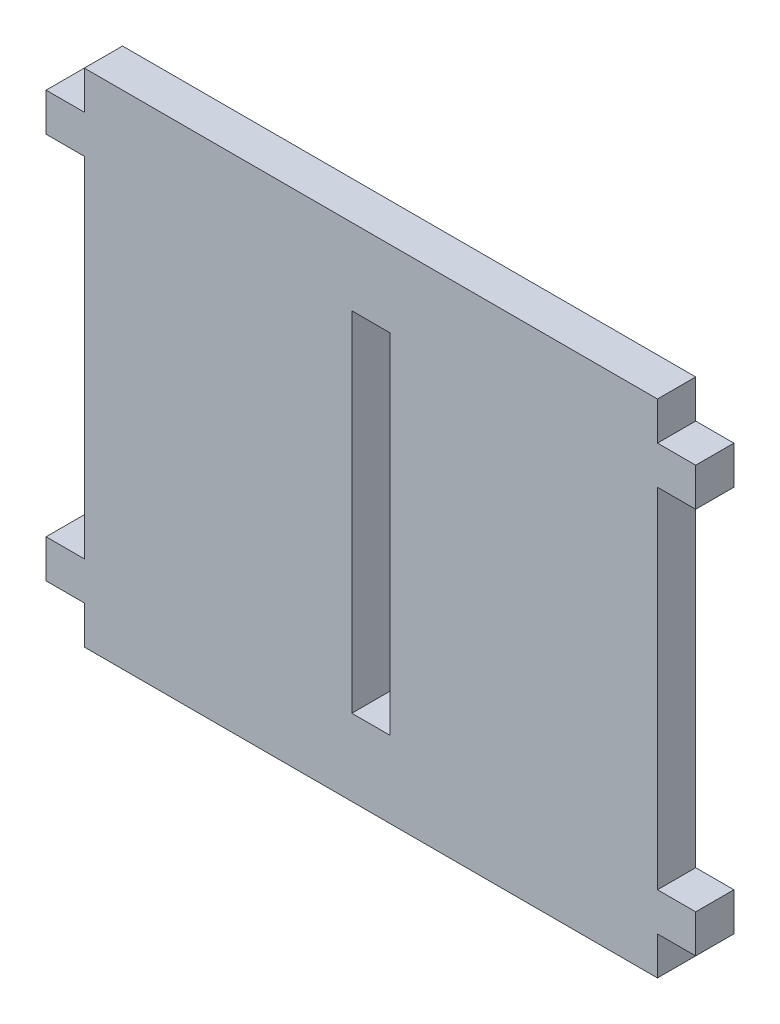
from build123d import *

# Parameters (mm, degrees)
SKETCH1_W           = 6.35
SKETCH1_H           = 57.927875
BOSS_EXTRUDE1_DEPTH = 6.35


with BuildPart() as part:
    # Sketch1 → Boss-Extrude1 (new body)
    with BuildSketch(Plane.XY):
        Polygon((-101.6, 35.3139375), (-107.95, 35.3139375), (-107.95, 28.9639375), (-101.6, 28.9639375), (-101.6, -28.9639375), (-107.95, -28.9639375), (-107.95, -35.3139375), (-101.6, -35.3139375), (-101.6, -41.6639375), (-6.35, -41.6639375), (-6.35, -35.3139375), (0, -35.3139375), (0, -28.9639375), (-6.35, -28.9639375), (-6.35, 28.9639375), (0, 28.9639375), (0, 35.3139375), (-6.35, 35.3139375), (-6.35, 41.6639375), (-101.6, 41.6639375), align=None)
        with Locations((-53.975, 0)):
            Rectangle(SKETCH1_W, SKETCH1_H, mode=Mode.SUBTRACT)
    extrude(amount=BOSS_EXTRUDE1_DEPTH)


solid = part.part
